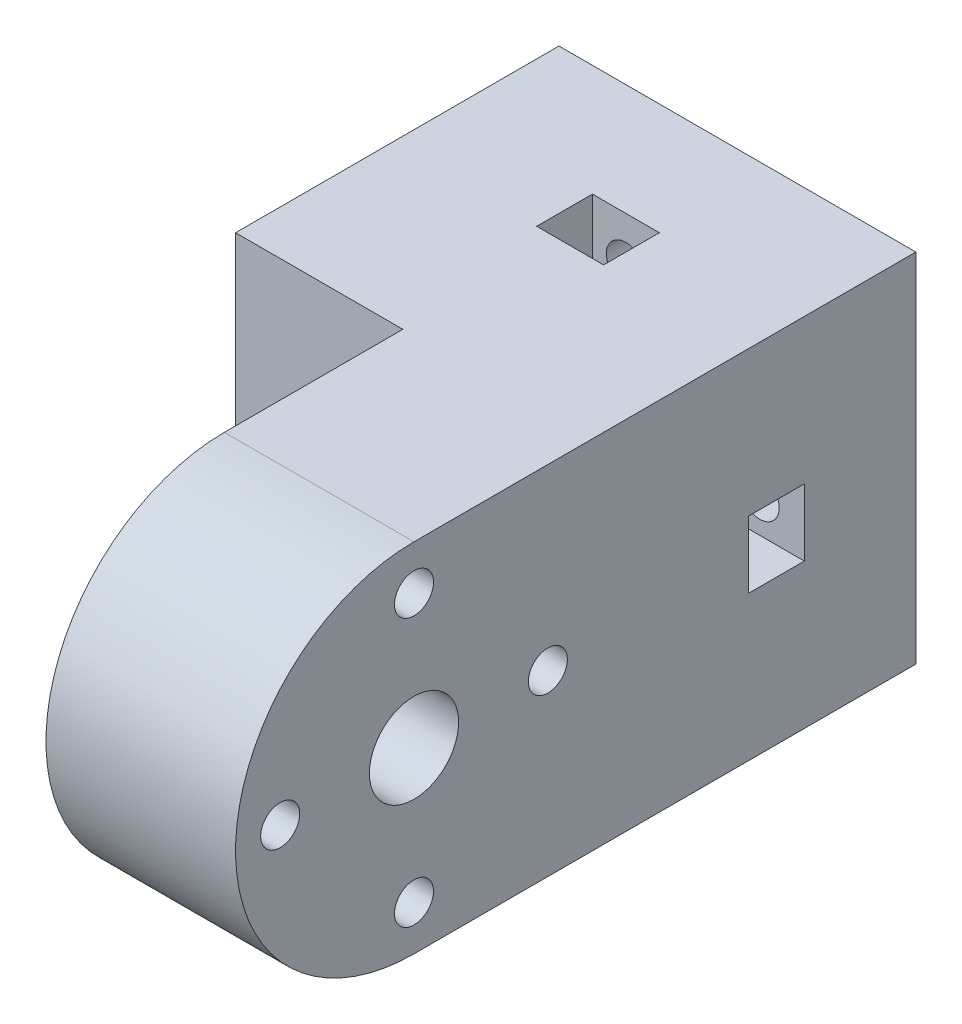
from build123d import *

# Parameters (mm, degrees)
BOSS_EXTRUDE1_DEPTH = 32
SKETCH4_R           = 16
CUT_EXTRUDE3_DEPTH  = 15
SKETCH5_R           = 7
SKETCH5_R_2         = 4
BOSS_EXTRUDE2_DEPTH = 17
SKETCH15_W          = 16
SKETCH15_H          = 32
CUT_EXTRUDE6_DEPTH  = 15
SKETCH16_W          = 32
SKETCH16_H          = 32
BOSS_EXTRUDE6_DEPTH = 20
SKETCH17_R          = 1.75
CUT_EXTRUDE8_DEPTH  = 49
SKETCH18_R          = 1.75
CUT_EXTRUDE9_DEPTH  = 51.695167423
CUT_EXTRUDE10_START = -10
CUT_EXTRUDE10_DEPTH = 5
SKETCH20_R          = 4.25
CUT_EXTRUDE11_DEPTH = 29


with BuildPart() as part:
    # Sketch1 → Boss-Extrude1 (new body)
    with BuildSketch(Plane(origin=(0, 0, 0), x_dir=(0, -1, 0), z_dir=(1, 0, 0))):
        with BuildLine():
            ThreePointArc((-16, 0), (0, 16), (16, 0))
            Line((16, 0), (16, 25))
            Line((16, 25), (-16, 25))
            Line((-16, 25), (-16, 0))
        make_face()
        with BuildLine():
            ThreePointArc((-4.5, 0), (0, 4.5), (4.5, 0))
            Line((4.5, 0), (16, 0))
            ThreePointArc((16, 0), (0, 16), (-16, 0))
            Line((-16, 0), (-4.5, 0))
        make_face()
        with BuildLine():
            Line((16, 0), (4.5, 0))
            ThreePointArc((4.5, 0), (0, -4.5), (-4.5, 0))
            Line((-4.5, 0), (-16, 0))
            ThreePointArc((-16, 0), (0, -16), (16, 0))
        make_face()
        with BuildLine():
            ThreePointArc((-4.5, 0), (0, 4.5), (4.5, 0))
            Line((4.5, 0), (16, 0))
            ThreePointArc((16, 0), (0, 16), (-16, 0))
            Line((-16, 0), (-4.5, 0))
        make_face()
        with BuildLine():
            Line((16, 0), (4.5, 0))
            ThreePointArc((4.5, 0), (0, -4.5), (-4.5, 0))
            Line((-4.5, 0), (-16, 0))
            ThreePointArc((-16, 0), (0, -16), (16, 0))
        make_face()
    extrude(amount=BOSS_EXTRUDE1_DEPTH)

    # Sketch4 → Cut-Extrude3 (cut)
    with BuildSketch(Plane.ZY):
        Circle(SKETCH4_R)
    extrude(amount=-CUT_EXTRUDE3_DEPTH, mode=Mode.SUBTRACT)

    # Sketch5 → Boss-Extrude2 (add)
    with BuildSketch(Plane.ZY.offset(-15)):
        Circle(SKETCH5_R)
        Circle(SKETCH5_R_2, mode=Mode.SUBTRACT)
    extrude(amount=-BOSS_EXTRUDE2_DEPTH)

    # Sketch15 → Cut-Extrude6 (cut)
    with BuildSketch(Plane.ZY):
        with Locations((-8, 0)):
            Rectangle(SKETCH15_W, SKETCH15_H)
    extrude(amount=-CUT_EXTRUDE6_DEPTH, mode=Mode.SUBTRACT)

    # Sketch16 → Boss-Extrude6 (add)
    with BuildSketch(Plane(origin=(0, 0, -25), x_dir=(-1, 0, 0), z_dir=(0, 0, -1))):
        with Locations((-16, 0)):
            Rectangle(SKETCH16_W, SKETCH16_H)
    extrude(amount=BOSS_EXTRUDE6_DEPTH)

    # Sketch17 → Cut-Extrude8 (cut, through all)
    with BuildSketch(Plane.XY.offset(-16)):
        with Locations((4, 0)):
            Circle(SKETCH17_R)
        with Locations((16, 12)):
            Circle(SKETCH17_R)
        with Locations((28, 0)):
            Circle(SKETCH17_R)
        with Locations((16, -12)):
            Circle(SKETCH17_R)
    extrude(amount=-CUT_EXTRUDE8_DEPTH, mode=Mode.SUBTRACT)

    # Sketch18 → Cut-Extrude9 (cut, through all)
    with BuildSketch(Plane.ZY.offset(-15)):
        with Locations((0, 12)):
            Circle(SKETCH18_R)
        with Locations((0, -12)):
            Circle(SKETCH18_R)
        with Locations((12, 0)):
            Circle(SKETCH18_R)
        with Locations(Location((-12, 0, 0), (0, 0, 180))):
            Circle(SKETCH18_R)
    extrude(amount=-CUT_EXTRUDE9_DEPTH, mode=Mode.SUBTRACT)

    # Sketch19 → Cut-Extrude10 (cut)
    with BuildSketch(Plane(origin=(0, 0, -45), x_dir=(-1, 0, 0), z_dir=(0, 0, -1)).offset(CUT_EXTRUDE10_START)):
        Polygon((0, 3), (-5.732050808, 3), (-7.464101615, 0), (-5.732050808, -3), (0, -3), align=None)
        Polygon((-16, -8.535898385), (-19, -10.267949192), (-19, -16), (-13, -16), (-13, -10.267949192), align=None)
        Polygon((-24.535898385, 0), (-26.267949192, 3), (-32, 3), (-32, -3), (-26.267949192, -3), align=None)
        Polygon((-16, 8.535898385), (-13, 10.267949192), (-13, 16), (-19, 16), (-19, 10.267949192), align=None)
    extrude(amount=-CUT_EXTRUDE10_DEPTH, mode=Mode.SUBTRACT)

    # Sketch20 → Cut-Extrude11 (cut)
    with BuildSketch(Plane(origin=(0, 0, -45), x_dir=(-1, 0, 0), z_dir=(0, 0, -1))):
        with Locations((-16, 0)):
            Circle(SKETCH20_R)
    extrude(amount=-CUT_EXTRUDE11_DEPTH, mode=Mode.SUBTRACT)


solid = part.part
